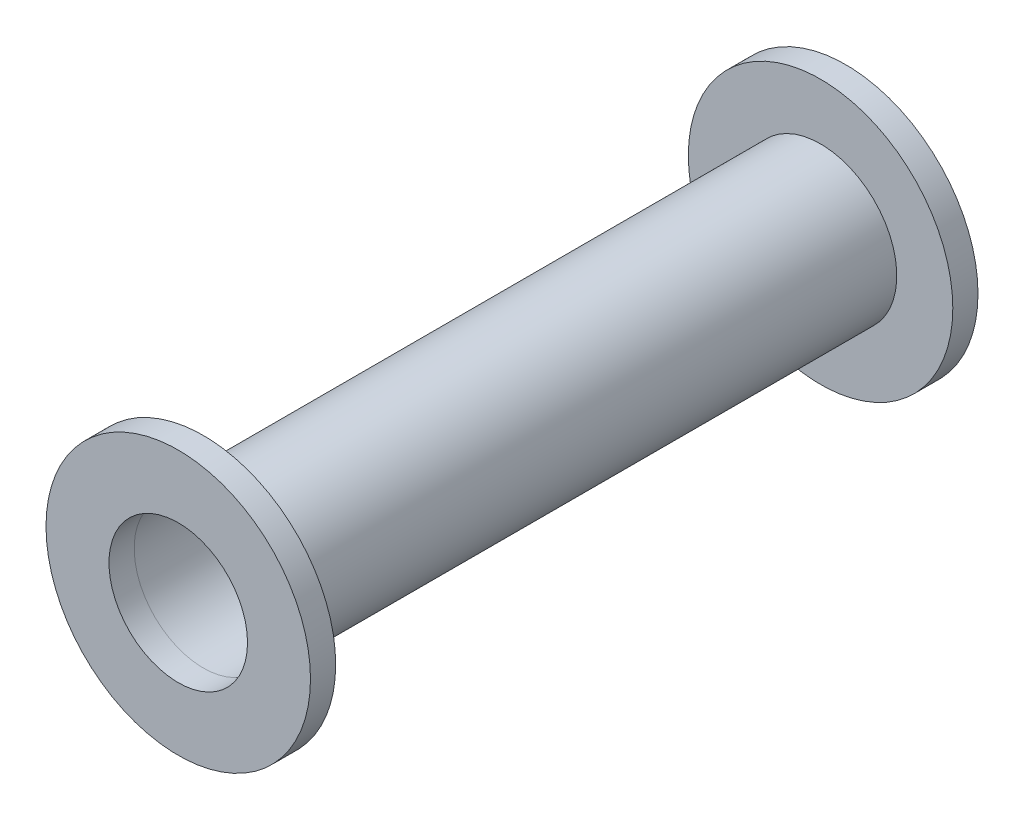
from build123d import *

# Parameters (mm, degrees)
SKETCH1_R      = 6.05
SKETCH1_R_2    = 5.55
EXTRUDE1_DEPTH = 49
SKETCH2_R      = 10.5
SKETCH2_R_2    = 5.5
EXTRUDE3_DEPTH = 2
EXTRUDE4_START = 2
SKETCH3_R      = 10.5
SKETCH3_R_2    = 5.5
EXTRUDE4_DEPTH = 2


with BuildPart() as part:
    # Sketch1 → Extrude1 (new body)
    with BuildSketch(Plane.XY):
        Circle(SKETCH1_R)
        Circle(SKETCH1_R_2, mode=Mode.SUBTRACT)
    extrude(amount=EXTRUDE1_DEPTH)

    # Sketch2 → Extrude3 (add)
    with BuildSketch(Plane.XY.offset(49)):
        Circle(SKETCH2_R)
        Circle(SKETCH2_R_2, mode=Mode.SUBTRACT)
    extrude(amount=EXTRUDE3_DEPTH)

    # Sketch3 → Extrude4 (add)
    with BuildSketch(Plane(origin=(0, 0, 0), x_dir=(-1, 0, 0), z_dir=(0, 0, -1)).offset(EXTRUDE4_START)):
        with Locations(Location((0, 0, 0), (0, 0, 180))):
            Circle(SKETCH3_R)
        with Locations(Location((0, 0, 0), (0, 0, 180))):
            Circle(SKETCH3_R_2, mode=Mode.SUBTRACT)
    extrude(amount=-EXTRUDE4_DEPTH)


solid = part.part
